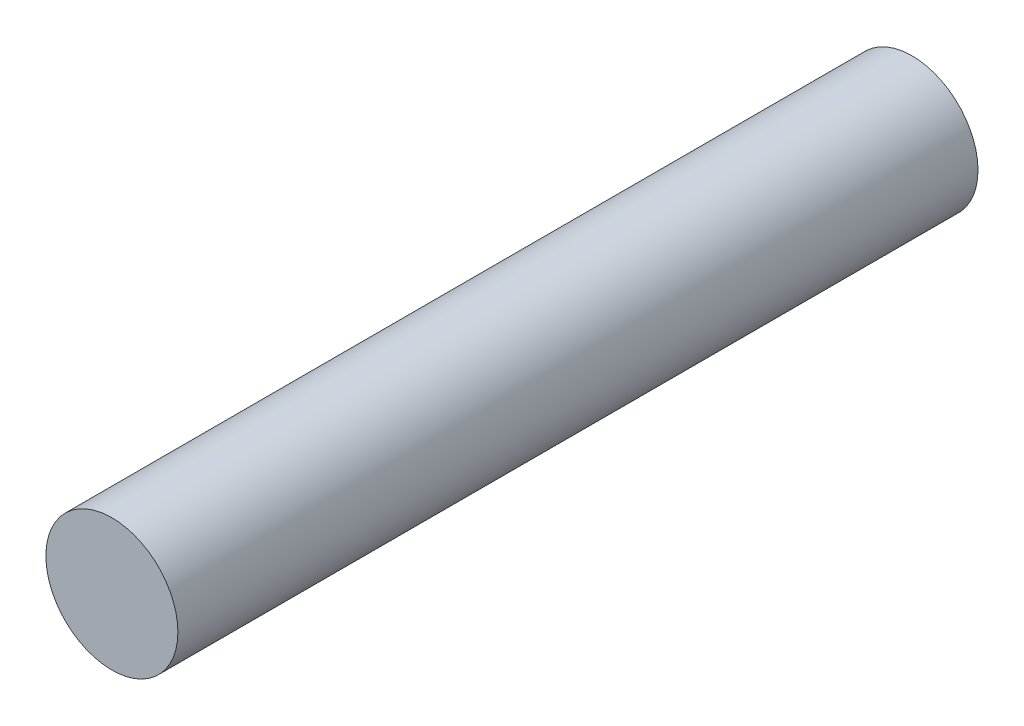
from build123d import *

# Parameters (mm, degrees)
SKETCH1_R           = 16.5
BOSS_EXTRUDE1_DEPTH = 200


with BuildPart() as part:
    # Sketch1 → Boss-Extrude1 (new body)
    with BuildSketch(Plane(origin=(0, 0, 0), x_dir=(0, 1, 0), z_dir=(0, 0, 1))):
        with Locations(Location((0, 0, 0), (0, 0, 270))):
            Circle(SKETCH1_R)
    extrude(amount=BOSS_EXTRUDE1_DEPTH)


solid = part.part
